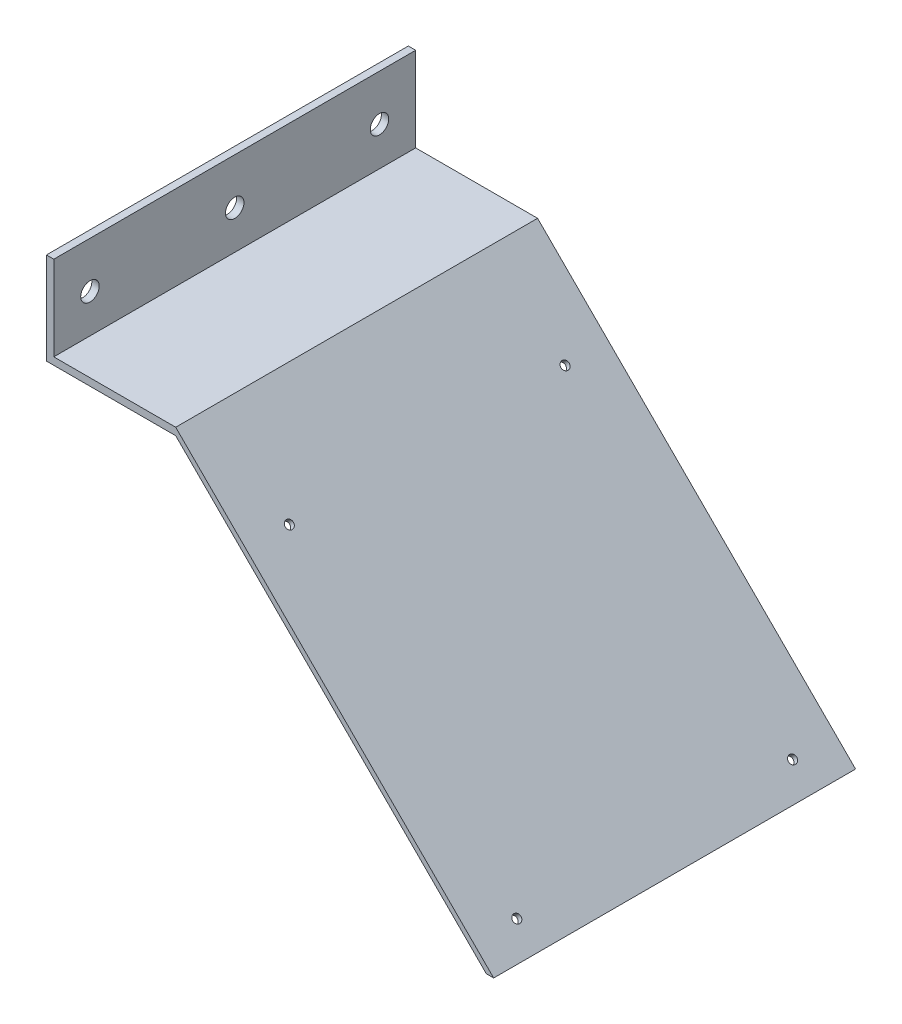
from build123d import *

# Parameters (mm, degrees)
BOSS_EXTRUDE1_DEPTH     = 100
CUT_EXTRUDE1_DEPTH      = 159.384645446
CUT_EXTRUDE1_DEPTH_BACK = 159.384645446
SKETCH2_R               = 1.13
F_4_40_TAPPED_HOLE1_D   = 2.2606
F_1_4_20_TAPPED_HOLE1_D = 5.1054


with BuildPart() as part:
    # Sketch1 → Boss-Extrude1 (new body)
    with BuildSketch(Plane.XY):
        Polygon((87.865570848, -85.833570848), (0, 2.032), (-33.68957, 2.032), (-33.68957, 25.4), (-35.72157, 25.4), (-35.72157, 0), (0, 0), (85.833570848, -85.833570848), align=None)
    extrude(amount=BOSS_EXTRUDE1_DEPTH)

    # Sketch2 → Cut-Extrude1 (cut, two sides: drawn at the far end of the back side and taken through both)
    with BuildSketch(Plane(origin=(1.016, 1.016, 0), x_dir=(0, 0, -1), z_dir=(0.707106781186546, 0.707106781186549, 0)).offset(-CUT_EXTRUDE1_DEPTH_BACK)):
        with Locations((-88.1, -26.137000979)):
            Circle(SKETCH2_R)
        with Locations((-11.9, -26.137000979)):
            Circle(SKETCH2_R)
        with Locations((-11.9, -115.037000979)):
            Circle(SKETCH2_R)
        with Locations((-88.1, -115.037000979)):
            Circle(SKETCH2_R)
    extrude(amount=CUT_EXTRUDE1_DEPTH + CUT_EXTRUDE1_DEPTH_BACK, mode=Mode.SUBTRACT)

    # #4-40 Tapped Hole1 (through all)
    with Locations(Plane(origin=(19.497650632, -17.465650632, 88.1), x_dir=(0.707106781187, -0.707106781187, 0), z_dir=(0.707106781187, 0.707106781187, 0))):
        with Locations((1e-09, 0), (1e-09, 76.2), (88.900000001, 76.2), (88.900000001, 0)):
            Hole(F_4_40_TAPPED_HOLE1_D / 2)

    # 1/4-20 Tapped Hole1 (through all)
    with Locations(Plane.ZY.offset(35.72157)):
        with Locations((10, 12.7), (50, 12.7), (90, 12.7)):
            Hole(F_1_4_20_TAPPED_HOLE1_D / 2)


solid = part.part
